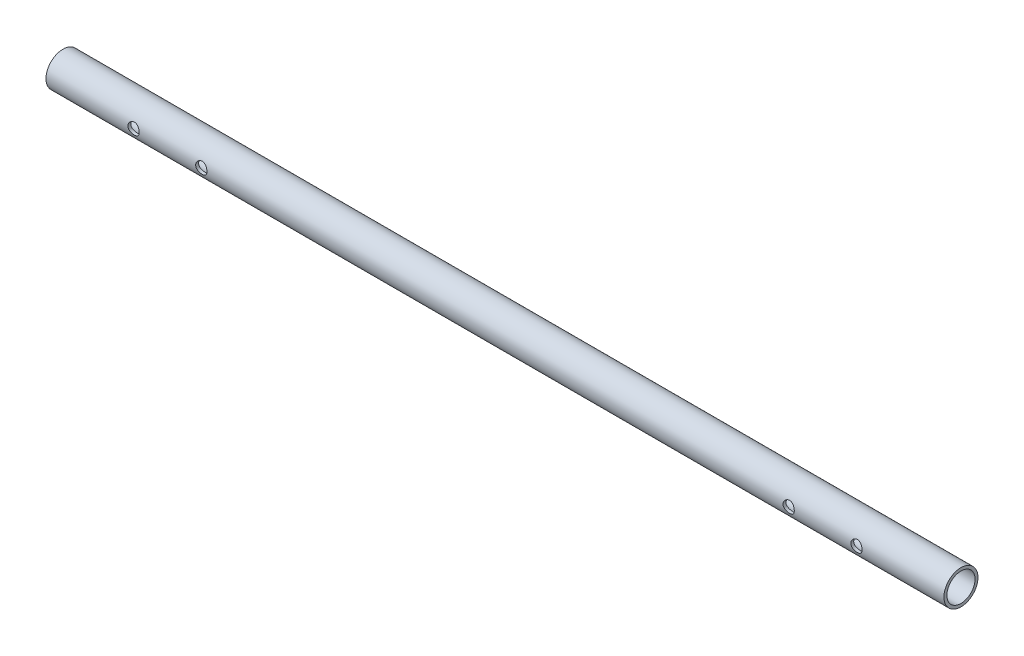
from build123d import *

# Parameters (mm, degrees)
SKETCH1_R           = 30.15
SKETCH1_R_2         = 24.9
BOSS_EXTRUDE1_DEPTH = 795
SKETCH5_R           = 10
CUT_EXTRUDE2_DEPTH  = 797.142603432


with BuildPart() as part:
    # Sketch1 → Boss-Extrude1 (new, symmetric)
    with BuildSketch(Plane(origin=(0, 0, 0), x_dir=(0, 0, -1), z_dir=(1, 0, 0))):
        Circle(SKETCH1_R)
        Circle(SKETCH1_R_2, mode=Mode.SUBTRACT)
    extrude(amount=BOSS_EXTRUDE1_DEPTH, both=True)

    # Sketch5 → Cut-Extrude2 (cut, symmetric)
    with BuildSketch(Plane.XY):
        with Locations((-520, 0)):
            Circle(SKETCH5_R)
        with Locations((-640, 0)):
            Circle(SKETCH5_R)
    cut_extrude2 = extrude(amount=CUT_EXTRUDE2_DEPTH, both=True, mode=Mode.SUBTRACT)

    # Mirror1: Cut-Extrude2 across plane
    add(cut_extrude2.mirror(Plane(origin=(0, 0, 0), x_dir=(0, 0, 1), z_dir=(1, 0, 0))), mode=Mode.SUBTRACT)


solid = part.part
